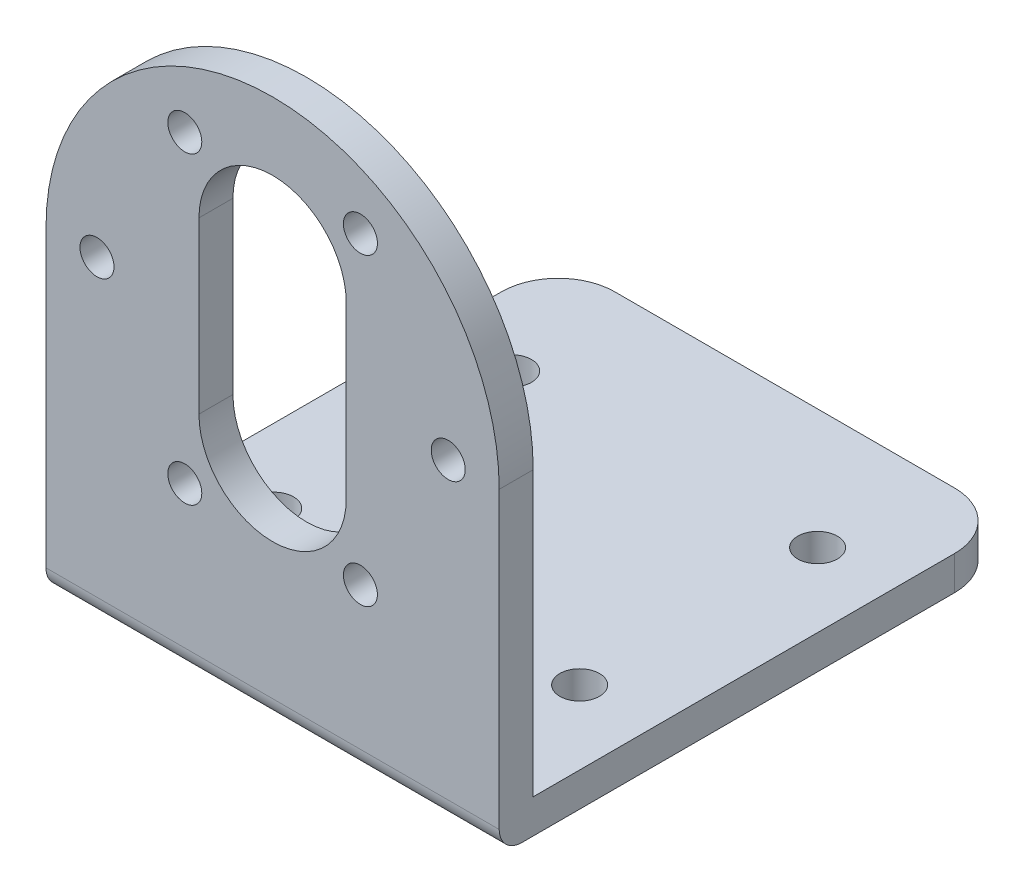
from build123d import *

# Parameters (mm, degrees)
CROQUIS1_R              = 1.5
SALIENTE_EXTRUIR1_DEPTH = 1.5
CORTAR_EXTRUIR3_DEPTH   = 3
CROQUIS3_W              = 40
CROQUIS3_H              = 3
SALIENTE_EXTRUIR2_DEPTH = 42.2
CROQUIS4_R              = 1.75
CORTAR_EXTRUIR5_DEPTH   = 42.2
REDONDEO1_R             = 2
REDONDEO2_R             = 5


with BuildPart() as part:
    # Croquis1 → Saliente-Extruir1 (new, symmetric)
    with BuildSketch(Plane.XY):
        with BuildLine():
            Line((-20, -24), (20, -24))
            Line((20, -24), (20, 4))
            ThreePointArc((20, 4), (0, 24), (-20, 4))
            Line((-20, 4), (-20, -24))
        make_face()
        with Locations((-15.5, 4)):
            Circle(CROQUIS1_R, mode=Mode.SUBTRACT)
        with Locations((-7.75, 17.423393759)):
            Circle(CROQUIS1_R, mode=Mode.SUBTRACT)
        with Locations((7.75, 17.423393759)):
            Circle(CROQUIS1_R, mode=Mode.SUBTRACT)
        with Locations((15.5, 4)):
            Circle(CROQUIS1_R, mode=Mode.SUBTRACT)
        with Locations((7.75, -9.423393759)):
            Circle(CROQUIS1_R, mode=Mode.SUBTRACT)
        with Locations((-7.75, -9.423393759)):
            Circle(CROQUIS1_R, mode=Mode.SUBTRACT)
    extrude(amount=SALIENTE_EXTRUIR1_DEPTH, both=True)

    # Croquis2 → Cortar-Extruir3 (cut)
    with BuildSketch(Plane.XY.offset(1.5)):
        with BuildLine():
            Line((6.5, 11.5), (6.5, -3.5))
            ThreePointArc((6.5, -3.5), (0, -10), (-6.5, -3.5))
            Line((-6.5, -3.5), (-6.5, 11.5))
            ThreePointArc((-6.5, 11.5), (0, 18), (6.5, 11.5))
        make_face()
    extrude(amount=-CORTAR_EXTRUIR3_DEPTH, mode=Mode.SUBTRACT)

    # Croquis3 → Saliente-Extruir2 (add)
    with BuildSketch(Plane(origin=(0, 0, -1.5), x_dir=(-1, 0, 0), z_dir=(0, 0, -1))):
        with Locations((0, -22.5)):
            Rectangle(CROQUIS3_W, CROQUIS3_H)
    extrude(amount=SALIENTE_EXTRUIR2_DEPTH)

    # Croquis4 → Cortar-Extruir5 (cut)
    with BuildSketch(Plane(origin=(0, -21, 0), x_dir=(1, 0, 0), z_dir=(0, 1, 0))):
        with Locations(Location((-13.5, 33.1, 0), (0, 0, 270))):
            Circle(CROQUIS4_R)
        with Locations(Location((13.5, 33.1, 0), (0, 0, 270))):
            Circle(CROQUIS4_R)
        with Locations(Location((13.5, 12.1, 0), (0, 0, 270))):
            Circle(CROQUIS4_R)
        with Locations(Location((-13.5, 12.1, 0), (0, 0, 270))):
            Circle(CROQUIS4_R)
    extrude(amount=-CORTAR_EXTRUIR5_DEPTH, mode=Mode.SUBTRACT)

    # Redondeo1
    redondeo1_edges = [part.edges().sort_by_distance(p)[0] for p in [
        (0, -24, 1.5),
    ]]
    fillet(redondeo1_edges, radius=REDONDEO1_R)

    # Redondeo2
    redondeo2_edges = [part.edges().sort_by_distance(p)[0] for p in [
        (20, -22.5, -43.7),
        (-20, -22.5, -43.7),
    ]]
    fillet(redondeo2_edges, radius=REDONDEO2_R)


solid = part.part
